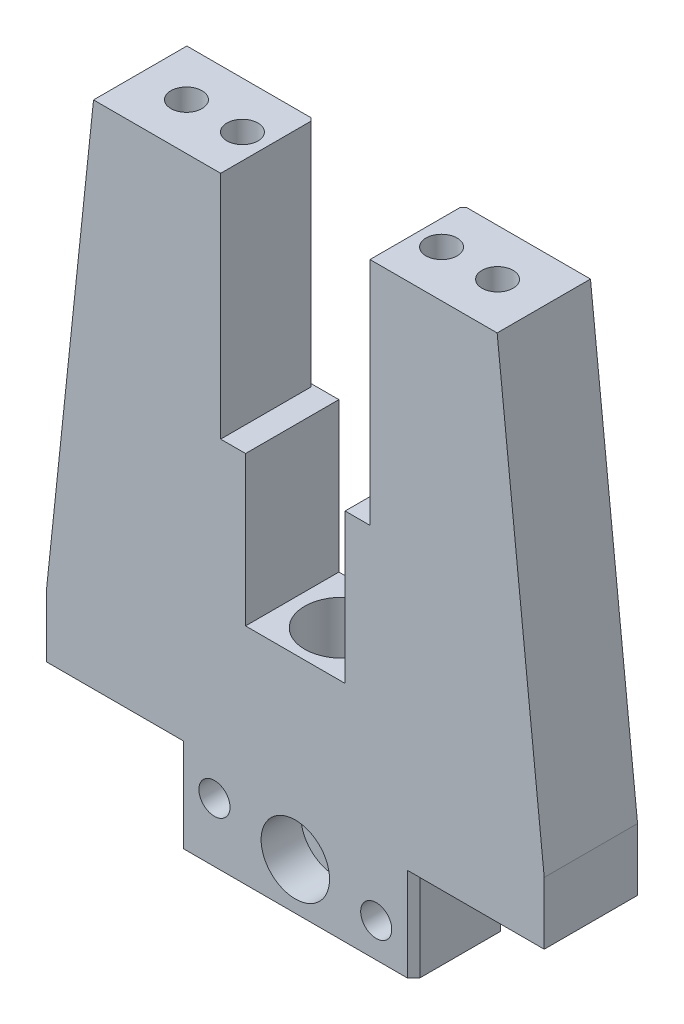
from build123d import *

# Parameters (mm, degrees)
ESTRUSIONE_ESTRUSIONE1_DEPTH                         = 15
FORO_5_0_5_1_D                                       = 5
FORO_5_0_5_1_DEPTH                                   = 16
FORO_5_0_5_1_TIP                                     = 1.502151548
FORO_FILETTATO_M6_1_D                                = 5
FORO_FILETTATO_M6_1_DEPTH                            = 20
FORO_FILETTATO_M6_1_TIP                              = 1.502151548
SCHIZZO7_R                                           = 6
TAGLIO_ESTRUSIONE1_DEPTH                             = 16.5
FORO_5_0_5_2_D                                       = 5
FORO_LAMATO_PER_VITE_M6_A_TESTA_CILINDRI_D           = 6.6
FORO_LAMATO_PER_VITE_M6_A_TESTA_CILINDRI_CBORE_D     = 11
FORO_LAMATO_PER_VITE_M6_A_TESTA_CILINDRI_CBORE_DEPTH = 6.4
SMUSSO1_SIZE                                         = 1
SMUSSO2_SIZE                                         = 0.5


with BuildPart() as part:
    # Schizzo1 → Estrusione-Estrusione1 (new body)
    with BuildSketch(Plane.XY):
        Polygon((19, 0), (-19, 0), (-19, 15), (-40, 15), (-40, 25), (-32.432495061, 97), (-12, 97), (-12, 60), (-8, 60), (-8, 36), (8, 36), (8, 60), (12, 60), (12, 97), (32.432495061, 97), (40, 25), (40, 15), (19, 15), align=None)
    extrude(amount=ESTRUSIONE_ESTRUSIONE1_DEPTH)

    # Foro Ø5.0 (5)-1
    with Locations(Plane(origin=(0, 97, 0), x_dir=(1, 0, 0), z_dir=(0, 1, 0))):
        with Locations((-16, -7.5), (16, -7.5)):
            Hole(FORO_5_0_5_1_D / 2, depth=FORO_5_0_5_1_DEPTH)
            with Locations((0, 0, -(FORO_5_0_5_1_DEPTH + FORO_5_0_5_1_TIP / 2))):  # 118° drill point
                Cone(0, FORO_5_0_5_1_D / 2, FORO_5_0_5_1_TIP, mode=Mode.SUBTRACT)

    # Foro filettato M6-1
    with Locations(Plane(origin=(0, 97, 0), x_dir=(1, 0, 0), z_dir=(0, 1, 0))):
        with Locations((-25, -7.5), (25, -7.5)):
            Hole(FORO_FILETTATO_M6_1_D / 2, depth=FORO_FILETTATO_M6_1_DEPTH)
            with Locations((0, 0, -(FORO_FILETTATO_M6_1_DEPTH + FORO_FILETTATO_M6_1_TIP / 2))):  # 118° drill point
                Cone(0, FORO_FILETTATO_M6_1_D / 2, FORO_FILETTATO_M6_1_TIP, mode=Mode.SUBTRACT)

    # Schizzo7 → Taglio-Estrusione1 (cut)
    with BuildSketch(Plane(origin=(0, 36, 0), x_dir=(1, 0, 0), z_dir=(0, 1, 0))):
        with Locations(Location((0, -7.5, 0), (0, 0, 270))):
            Circle(SCHIZZO7_R)
    extrude(amount=-TAGLIO_ESTRUSIONE1_DEPTH, mode=Mode.SUBTRACT)

    # Foro Ø5.0 (5)-2 (through all)
    with Locations(Plane(origin=(0, 0, 0), x_dir=(-1, 0, 0), z_dir=(0, 0, -1))):
        with Locations((-13, 5.5), (13, 9.5)):
            Hole(FORO_5_0_5_2_D / 2)

    # Foro lamato per Vite M6 a testa cilindrica-1 (through all)
    with Locations(Plane.XY.offset(15)):
        with Locations((0, 7.5)):
            CounterBoreHole(FORO_LAMATO_PER_VITE_M6_A_TESTA_CILINDRI_D / 2, FORO_LAMATO_PER_VITE_M6_A_TESTA_CILINDRI_CBORE_D / 2, FORO_LAMATO_PER_VITE_M6_A_TESTA_CILINDRI_CBORE_DEPTH)

    # Smusso1
    smusso1_edges = [part.edges().sort_by_distance(p)[0] for p in [
        (-19, 7.5, 15),
        (19, 7.5, 15),
        (19, 7.5, 0),
        (-19, 7.5, 0),
    ]]
    chamfer(smusso1_edges, length=SMUSSO1_SIZE)

    # Smusso2
    smusso2_edges = [part.edges().sort_by_distance(p)[0] for p in [
        (-12, 78.5, 0),
        (12, 78.5, 0),
    ]]
    chamfer(smusso2_edges, length=SMUSSO2_SIZE)


solid = part.part
